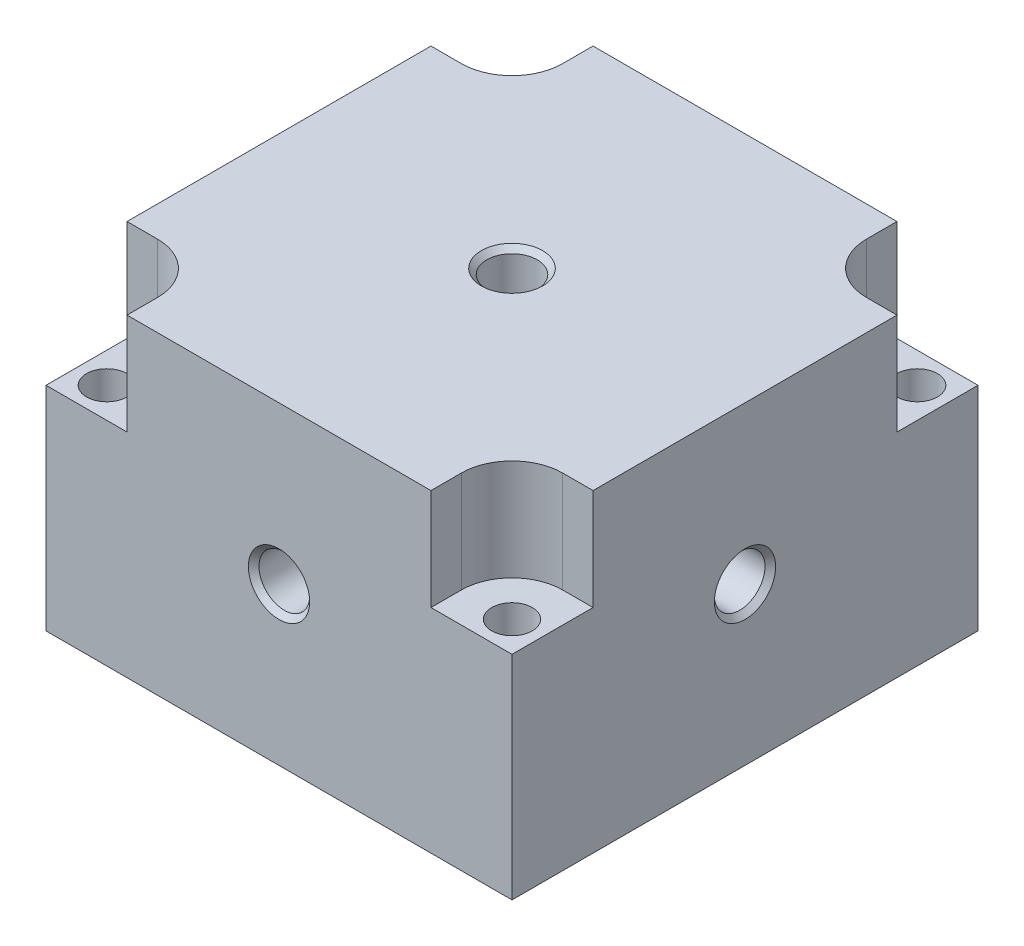
from build123d import *

# Parameters (mm, degrees)
SKETCH_1_W                   = 46
SKETCH_1_H                   = 46
EXTRUDE_1_DEPTH              = 15.5
CUT_EXTRUDE_1_DEPTH          = 10
SKETCH_4_R                   = 2
CUT_EXTRUDE_2_DEPTH          = 39.716921365
PATTERN_CIRCULAR_1_COUNT     = 4
HOLE_WIZARD_M6_2_D           = 5
HOLE_WIZARD_M6_2_DEPTH       = 7
HOLE_WIZARD_M6_2_CSINK_D     = 6.05
HOLE_WIZARD_M6_2_CSINK_ANGLE = 90
HOLE_WIZARD_M6_2_TIP         = 1.502151548


with BuildPart() as part:
    # 草图1 → 凸台-拉伸1 (new, symmetric)
    with BuildSketch(Plane(origin=(0, 0, 0), x_dir=(1, 0, 0), z_dir=(0, 1, 0))):
        Rectangle(SKETCH_1_W, SKETCH_1_H)
    extrude(amount=EXTRUDE_1_DEPTH, both=True)

    # 草图2 → 切除-拉伸1 (cut)
    with BuildSketch(Plane(origin=(0, 15.5, 0), x_dir=(1, 0, 0), z_dir=(0, 1, 0))):
        with BuildLine():
            Line((15, 20), (15, 23))
            Line((15, 23), (23, 23))
            Line((23, 23), (23, 15))
            Line((23, 15), (20, 15))
            ThreePointArc((20, 15), (16.464466094, 16.464466094), (15, 20))
        make_face()
        with BuildLine():
            Line((20, -15), (23, -15))
            Line((23, -15), (23, -23))
            Line((23, -23), (15, -23))
            Line((15, -23), (15, -20))
            ThreePointArc((15, -20), (16.464466094, -16.464466094), (20, -15))
        make_face()
        with BuildLine():
            Line((-15, -20), (-15, -23))
            Line((-15, -23), (-23, -23))
            Line((-23, -23), (-23, -15))
            Line((-23, -15), (-20, -15))
            ThreePointArc((-20, -15), (-16.464466094, -16.464466094), (-15, -20))
        make_face()
        with BuildLine():
            Line((-20, 15), (-23, 15))
            Line((-23, 15), (-23, 23))
            Line((-23, 23), (-15, 23))
            Line((-15, 23), (-15, 20))
            ThreePointArc((-15, 20), (-16.464466094, 16.464466094), (-20, 15))
        make_face()
    extrude(amount=-CUT_EXTRUDE_1_DEPTH, mode=Mode.SUBTRACT)

    # 草图4 → 切除-拉伸2 (cut, through all)
    with BuildSketch(Plane(origin=(0, 5.5, 0), x_dir=(1, 0, 0), z_dir=(0, 1, 0))):
        with Locations(Location((20, 20, 0), (0, 0, 270))):
            Circle(SKETCH_4_R)
        with Locations(Location((20, -20, 0), (0, 0, 270))):
            Circle(SKETCH_4_R)
        with Locations(Location((-20, -20, 0), (0, 0, 270))):
            Circle(SKETCH_4_R)
        with Locations(Location((-20, 20, 0), (0, 0, 270))):
            Circle(SKETCH_4_R)
    extrude(amount=-CUT_EXTRUDE_2_DEPTH, mode=Mode.SUBTRACT)

    # 草图6 → M6 螺纹孔1 (revolve, cut)
    with BuildSketch(Plane(origin=(0, 0, 23), x_dir=(0, -1, 0), z_dir=(1, 0, 0))):
        Polygon((0, 0), (0, 8.502151548), (2.5, 7), (2.5, 0.525), (3.025, 0), align=None)
    hole_wizard_m6_1 = revolve(axis=Axis((0, 0, 29.35), (0, 0, -1)), mode=Mode.SUBTRACT)

    # 阵列(圆周)1: M6 螺纹孔1 ×4 about axis
    pattern_circular_1_axis = Axis((0, 15.5, 0), (0, 1, 0))
    for i in range(1, PATTERN_CIRCULAR_1_COUNT):
        add(hole_wizard_m6_1.rotate(pattern_circular_1_axis, i * 360 / PATTERN_CIRCULAR_1_COUNT), mode=Mode.SUBTRACT)

    # M6 螺纹孔2
    with Locations(Plane(origin=(0, 15.5, 0), x_dir=(1, 0, 0), z_dir=(0, 1, 0))):
        with Locations((0, 0)):
            CounterSinkHole(HOLE_WIZARD_M6_2_D / 2, HOLE_WIZARD_M6_2_CSINK_D / 2, depth=HOLE_WIZARD_M6_2_DEPTH, counter_sink_angle=HOLE_WIZARD_M6_2_CSINK_ANGLE)
            with Locations((0, 0, -(HOLE_WIZARD_M6_2_DEPTH + HOLE_WIZARD_M6_2_TIP / 2))):  # 118° drill point
                Cone(0, HOLE_WIZARD_M6_2_D / 2, HOLE_WIZARD_M6_2_TIP, mode=Mode.SUBTRACT)


solid = part.part
